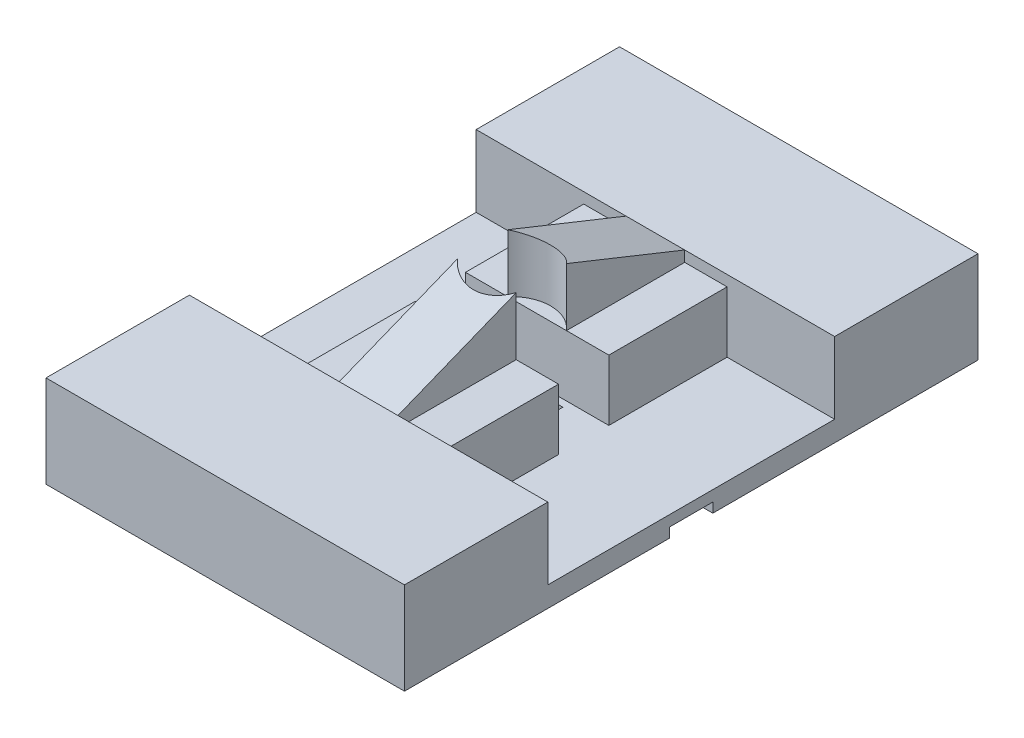
from build123d import *

# Parameters (mm, degrees)
BOSS_EXTRUDE1_DEPTH  = 3.15
SKETCH3_W            = 12.18
SKETCH3_H            = 10.02
SKETCH3_W_2          = 8.18
SKETCH3_H_2          = 5.02
BOSS_EXTRUDE2_DEPTH  = 1.5
SKETCH5_W            = 12.18
SKETCH5_H            = 10.02
CUT_EXTRUDE1_DEPTH   = 0.3
SKETCH7_W            = 50
SKETCH7_H            = 80
SKETCH7_W_2          = 12.18
SKETCH7_H_2          = 10.02
BOSS_EXTRUDE7_DEPTH  = 2.85
SKETCH8_W            = 50
SKETCH8_H            = 20
BOSS_EXTRUDE8_DEPTH  = 10
SKETCH9_W            = 18.91
SKETCH9_H            = 6.02
CUT_EXTRUDE2_DEPTH   = 1.35
SKETCH11_W           = 20
SKETCH11_H           = 16.49
BOSS_EXTRUDE9_DEPTH  = 8.5
BOSS_EXTRUDE10_DEPTH = 8.1
CUT_EXTRUDE3_DEPTH   = 10


with BuildPart() as part:
    # Sketch1 → Boss-Extrude1 (new body)
    with BuildSketch(Plane(origin=(0, 0, 0), x_dir=(1, 0, 0), z_dir=(0, 1, 0))):
        Polygon((-0.5, -0.5), (8.68, -0.5), (8.68, 0), (10.18, 0), (10.18, -2), (-2, -2), (-2, 8.02), (10.18, 8.02), (10.18, 6.02), (8.68, 6.02), (8.68, 6.52), (-0.5, 6.52), align=None)
    extrude(amount=BOSS_EXTRUDE1_DEPTH)

    # Sketch3 → Boss-Extrude2 (add)
    with BuildSketch(Plane(origin=(0, 3.15, 0), x_dir=(1, 0, 0), z_dir=(0, 1, 0))):
        with Locations((4.09, 3.01)):
            Rectangle(SKETCH3_W, SKETCH3_H)
        with Locations((4.59, 3.01)):
            Rectangle(SKETCH3_W_2, SKETCH3_H_2, mode=Mode.SUBTRACT)
    extrude(amount=-BOSS_EXTRUDE2_DEPTH)

    # Sketch5 → Cut-Extrude1 (cut)
    with BuildSketch(Plane.XZ):
        with Locations((4.09, -3.01)):
            Rectangle(SKETCH5_W, SKETCH5_H)
    extrude(amount=-CUT_EXTRUDE1_DEPTH, mode=Mode.SUBTRACT)

    # Sketch7 → Boss-Extrude7 (add)
    with BuildSketch(Plane(origin=(0, 3.15, 0), x_dir=(1, 0, 0), z_dir=(0, 1, 0))):
        with Locations((4.09, 3.01)):
            Rectangle(SKETCH7_W, SKETCH7_H)
        with Locations((4.09, 3.01)):
            Rectangle(SKETCH7_W_2, SKETCH7_H_2, mode=Mode.SUBTRACT)
    extrude(amount=-BOSS_EXTRUDE7_DEPTH)

    # Sketch8 → Boss-Extrude8 (add)
    with BuildSketch(Plane(origin=(0, 3.15, 0), x_dir=(1, 0, 0), z_dir=(0, 1, 0))):
        with Locations((4.09, -26.99)):
            Rectangle(SKETCH8_W, SKETCH8_H)
    boss_extrude8 = extrude(amount=BOSS_EXTRUDE8_DEPTH)

    # Sketch9 → Cut-Extrude2 (cut)
    with BuildSketch(Plane.XZ.offset(-0.3)):
        with Locations((19.635, -3.01)):
            Rectangle(SKETCH9_W, SKETCH9_H)
    extrude(amount=-CUT_EXTRUDE2_DEPTH, mode=Mode.SUBTRACT)

    # Sketch11 → Boss-Extrude9 (add)
    with BuildSketch(Plane(origin=(0, 3.15, 0), x_dir=(1, 0, 0), z_dir=(0, 1, 0))):
        with Locations((4.09, -8.745)):
            Rectangle(SKETCH11_W, SKETCH11_H)
    boss_extrude9 = extrude(amount=BOSS_EXTRUDE9_DEPTH)

    # Sketch12 → Boss-Extrude10 (add)
    with BuildSketch(Plane(origin=(0, 11.65, 0), x_dir=(1, 0, 0), z_dir=(0, 1, 0))):
        with BuildLine():
            Line((0, -0.5), (0, -16.99))
            Line((0, -16.99), (8.18, -16.99))
            Line((8.18, -16.99), (8.18, -0.5))
            ThreePointArc((8.18, -0.5), (4.09, -2.379638207), (0, -0.5))
        make_face()
    boss_extrude10 = extrude(amount=BOSS_EXTRUDE10_DEPTH)

    # Sketch13 → Cut-Extrude3 (cut)
    with BuildSketch(Plane(origin=(8.18, 0, 0), x_dir=(0, 0, -1), z_dir=(1, 0, 0))):
        Polygon((-16.99, 13.15), (-0.5, 19.75), (-16.99, 19.75), align=None)
    cut_extrude3 = extrude(amount=-CUT_EXTRUDE3_DEPTH, mode=Mode.SUBTRACT)

    # Mirror2: Boss-Extrude8, Boss-Extrude9, Boss-Extrude10, Cut-Extrude3 across plane
    add(boss_extrude8.mirror(Plane.XY.offset(-3.01)))
    add(boss_extrude9.mirror(Plane.XY.offset(-3.01)))
    add(boss_extrude10.mirror(Plane.XY.offset(-3.01)))
    add(cut_extrude3.mirror(Plane.XY.offset(-3.01)), mode=Mode.SUBTRACT)


solid = part.part
